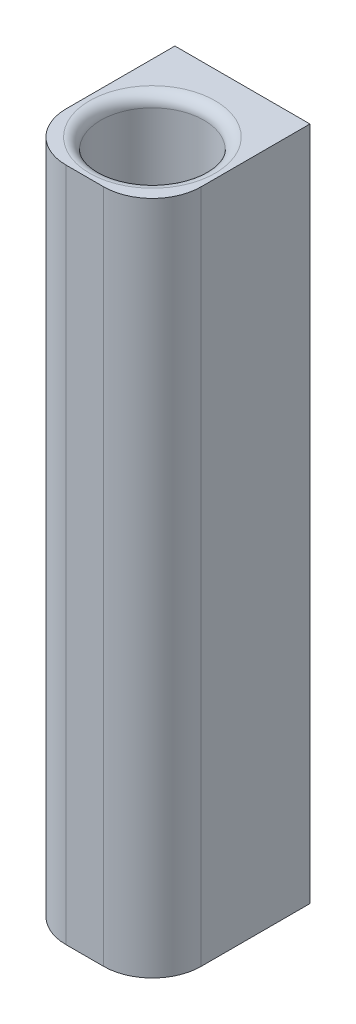
from build123d import *

# Parameters (mm, degrees)
SKETCH1_R           = 13.75
BOSS_EXTRUDE1_DEPTH = 180
FILLET1_R           = 13
FILLET2_R           = 3


with BuildPart() as part:
    # Sketch1 → Boss-Extrude1 (new body)
    with BuildSketch(Plane(origin=(0, 0, 0), x_dir=(1, 0, 0), z_dir=(0, 1, 0))):
        Polygon((0, 29.837240524), (-18, 29.837240524), (-18, -12.162759476), (18, -12.162759476), (18, 29.837240524), align=None)
        with Locations(Location((0, 5.837240524, 0), (0, 0, 90))):
            Circle(SKETCH1_R, mode=Mode.SUBTRACT)
    extrude(amount=BOSS_EXTRUDE1_DEPTH)

    # Fillet1
    fillet1_edges = [part.edges().sort_by_distance(p)[0] for p in [
        (18, 90, 12.162759476),
        (-18, 90, 12.162759476),
    ]]
    fillet(fillet1_edges, radius=FILLET1_R)

    # Fillet2
    fillet2_edges = [part.edges().sort_by_distance(p)[0] for p in [
        (0, 0, 7.912759476),
        (0, 180, 7.912759476),
    ]]
    fillet(fillet2_edges, radius=FILLET2_R)


solid = part.part
